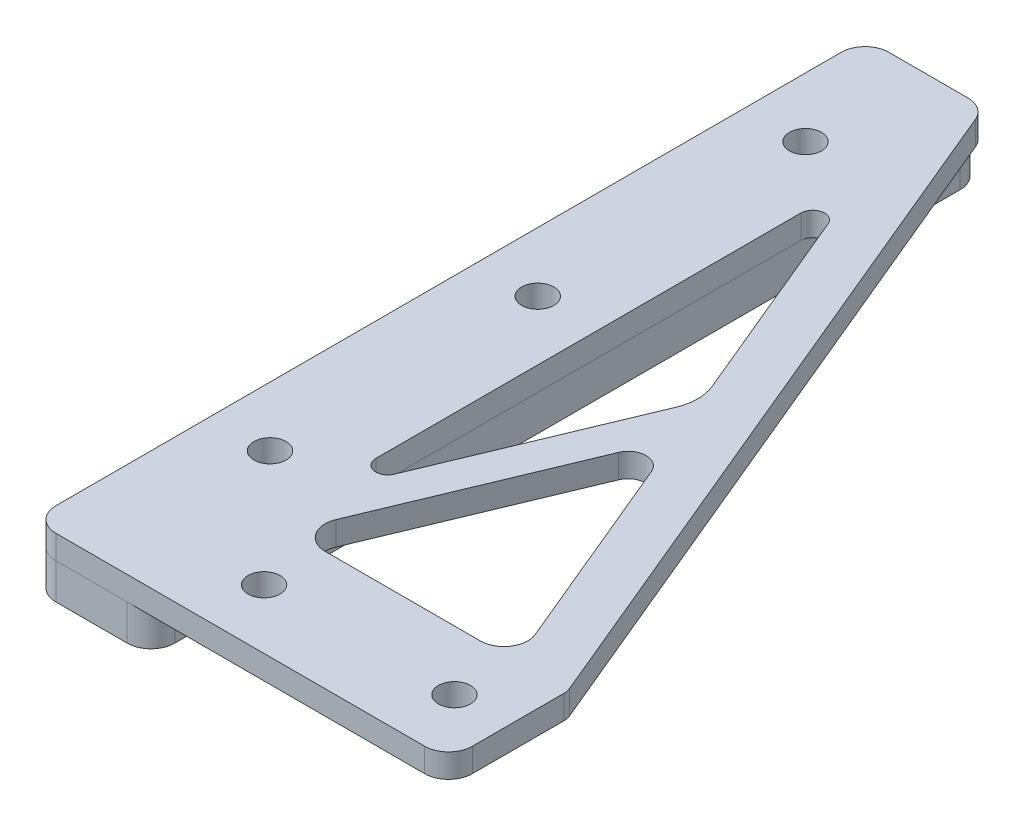
from build123d import *
from OCP.BRepFilletAPI import BRepFilletAPI_MakeFillet

# Parameters (mm, degrees)
EXTRUDE_1_DEPTH     = 2
CUT_EXTRUDE_1_DEPTH = 3
SKETCH_3_R          = 1.35
CUT_EXTRUDE_2_DEPTH = 79.287930104
FILLET_1_R1         = 2
FILLET_1_R2         = 1
FILLET_1_R3         = 1.5
FILLET_1_R4         = 4
SKETCH_4_W          = 10
SKETCH_4_H          = 70
SKETCH_4_R          = 1.35
EXTRUDE_2_DEPTH     = 3
FILLET_2_R          = 2


with BuildPart() as part:
    # 草图1 → 凸台-拉伸1 (new body)
    with BuildSketch(Plane(origin=(0, 0, 0), x_dir=(1, 0, 0), z_dir=(0, 1, 0))):
        Polygon((0, 0), (35, 0), (35, 10), (10, 70), (0, 70), align=None)
    extrude(amount=EXTRUDE_1_DEPTH)

    # 草图2 → 切除-拉伸1 (cut)
    with BuildSketch(Plane(origin=(0, 2, 0), x_dir=(1, 0, 0), z_dir=(0, 1, 0))):
        Polygon((19.520833333, 36.75), (10, 59.6), (10, 13.9), align=None)
        Polygon((30.666666667, 10), (21.145833333, 32.85), (11.625, 10), align=None)
    extrude(amount=-CUT_EXTRUDE_1_DEPTH, mode=Mode.SUBTRACT)

    # 草图3 → 切除-拉伸2 (cut, through all)
    with BuildSketch(Plane(origin=(0, 2, 0), x_dir=(1, 0, 0), z_dir=(0, 1, 0))):
        with Locations((30.5, 5)):
            Circle(SKETCH_3_R)
        with Locations((14.5, 5)):
            Circle(SKETCH_3_R)
        with Locations((5, 15)):
            Circle(SKETCH_3_R)
        with Locations((5, 60)):
            Circle(SKETCH_3_R)
        with Locations((5, 37.5)):
            Circle(SKETCH_3_R)
    extrude(amount=-CUT_EXTRUDE_2_DEPTH, mode=Mode.SUBTRACT)

    # 圆角1: one fillet with a radius per group of edges: ONE call of the kernel's fillet builder (fillet() takes one radius for all edges)
    fillet_1_edges_1 = [part.edges().sort_by_distance(p)[0] for p in [
        (30.666666667, 1, -10),
        (0, 1, 0),
        (35, 1, 0),
        (10, 1, -70),
        (0, 1, -70),
        (11.625, 1, -10),
    ]]
    fillet_1_edges_2 = [part.edges().sort_by_distance(p)[0] for p in [
        (10, 1, -59.6),
        (10, 1, -13.9),
    ]]
    fillet_1_edges_3 = [part.edges().sort_by_distance(p)[0] for p in [
        (35, 1, -10),
        (21.145833333, 1, -32.85),
    ]]
    fillet_1_edges_4 = [part.edges().sort_by_distance(p)[0] for p in [
        (19.520833333, 1, -36.75),
    ]]
    fillet_1 = BRepFilletAPI_MakeFillet(part.part.solid().wrapped)
    for e in fillet_1_edges_1:
        fillet_1.Add(FILLET_1_R1, e.wrapped)
    for e in fillet_1_edges_2:
        fillet_1.Add(FILLET_1_R2, e.wrapped)
    for e in fillet_1_edges_3:
        fillet_1.Add(FILLET_1_R3, e.wrapped)
    for e in fillet_1_edges_4:
        fillet_1.Add(FILLET_1_R4, e.wrapped)
    add(Compound.cast(fillet_1.Shape()), mode=Mode.REPLACE)


with BuildPart() as body_2:
    # 草图4 → 凸台-拉伸2 (new body)
    with BuildSketch(Plane.XZ):
        with Locations((5, -35)):
            Rectangle(SKETCH_4_W, SKETCH_4_H)
        with Locations((5, -15)):
            Circle(SKETCH_4_R, mode=Mode.SUBTRACT)
        with Locations((5, -37.5)):
            Circle(SKETCH_4_R, mode=Mode.SUBTRACT)
        with Locations((5, -60)):
            Circle(SKETCH_4_R, mode=Mode.SUBTRACT)
    extrude(amount=EXTRUDE_2_DEPTH)

    # 圆角2
    fillet_2_edges = [body_2.edges().sort_by_distance(p)[0] for p in [
        (0, -1.5, -70),
        (0, -1.5, 0),
        (10, -1.5, 0),
        (10, -1.5, -70),
    ]]
    fillet(fillet_2_edges, radius=FILLET_2_R)


solid = Compound([part.part, body_2.part])
